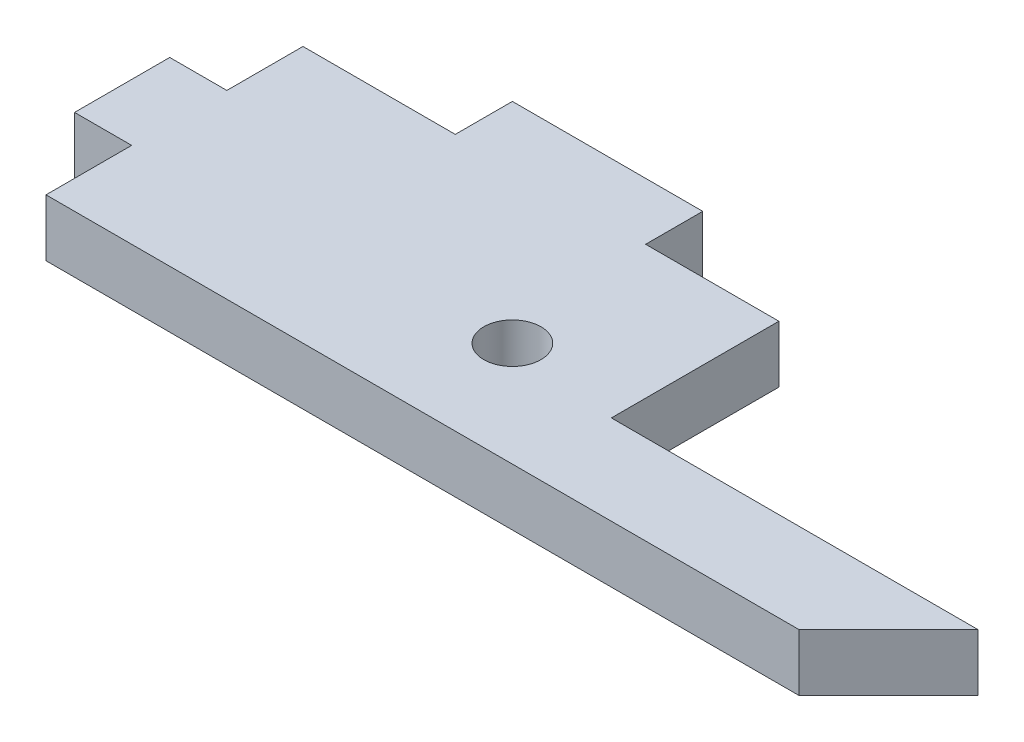
from build123d import *

# Parameters (mm, degrees)
SKETCH1_R           = 1.5
BOSS_EXTRUDE1_DEPTH = 3


with BuildPart() as part:
    # Sketch1 → Boss-Extrude1 (new body)
    with BuildSketch(Plane(origin=(0, 0, 0), x_dir=(1, 0, 0), z_dir=(0, 1, 0))):
        Polygon((-37.889024654, 3.81895344), (-27.889024654, 3.81895344), (-27.889024654, 0.81895344), (-20.889024654, 0.81895344), (-20.889024654, -7.98104656), (-1.629024654, -7.98104656), (-6.329024654, -12.68104656), (-45.889024654, -12.68104656), (-45.889024654, -8.18104656), (-48.889024654, -8.18104656), (-48.889024654, -3.18104656), (-45.889024654, -3.18104656), (-45.889024654, 0.81895344), (-37.889024654, 0.81895344), align=None)
        with Locations(Location((-26.889024654, -7.18104656, 0), (0, 0, 270))):
            Circle(SKETCH1_R, mode=Mode.SUBTRACT)
    extrude(amount=BOSS_EXTRUDE1_DEPTH)


solid = part.part
